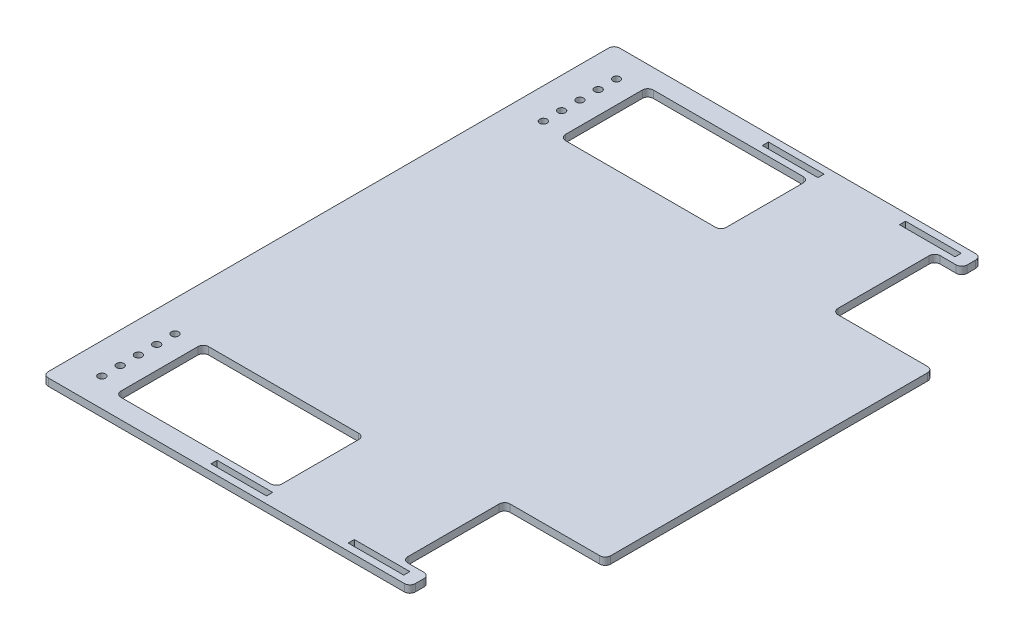
from build123d import *

# Parameters (mm, degrees)
SKETCH1_R           = 2
SKETCH1_W           = 30.4
SKETCH1_H           = 3.35
SKETCH1_W_2         = 88
SKETCH1_H_2         = 48
BOSS_EXTRUDE1_DEPTH = 4
FILLET1_R           = 3


with BuildPart() as part:
    # Sketch1 → Boss-Extrude1 (new body)
    with BuildSketch(Plane(origin=(0, 0, 0), x_dir=(1, 0, 0), z_dir=(0, 1, 0))):
        Polygon((-112.8, 156.215), (-112.8, -156.215), (87.95, -156.215), (87.95, -145.555), (73.17, -145.555), (73.17, -89.625), (128.17, -89.625), (128.17, 89.625), (73.17, 89.625), (73.17, 145.555), (87.95, 145.555), (87.95, 156.215), align=None)
        with Locations(Location((-96, 140.715, 0), (0, 0, 270))):
            Circle(SKETCH1_R, mode=Mode.SUBTRACT)
        with Locations(Location((-96, 130.715, 0), (0, 0, 270))):
            Circle(SKETCH1_R, mode=Mode.SUBTRACT)
        with Locations(Location((-96, 120.715, 0), (0, 0, 270))):
            Circle(SKETCH1_R, mode=Mode.SUBTRACT)
        with Locations(Location((-96, 110.715, 0), (0, 0, 270))):
            Circle(SKETCH1_R, mode=Mode.SUBTRACT)
        with Locations(Location((-96, 100.715, 0), (0, 0, 270))):
            Circle(SKETCH1_R, mode=Mode.SUBTRACT)
        with Locations(Location((-96, -100.715, 0), (0, 0, 90))):
            Circle(SKETCH1_R, mode=Mode.SUBTRACT)
        with Locations(Location((-96, -110.715, 0), (0, 0, 90))):
            Circle(SKETCH1_R, mode=Mode.SUBTRACT)
        with Locations(Location((-96, -120.715, 0), (0, 0, 90))):
            Circle(SKETCH1_R, mode=Mode.SUBTRACT)
        with Locations(Location((-96, -130.715, 0), (0, 0, 90))):
            Circle(SKETCH1_R, mode=Mode.SUBTRACT)
        with Locations(Location((-96, -140.715, 0), (0, 0, 90))):
            Circle(SKETCH1_R, mode=Mode.SUBTRACT)
        with Locations((65.59, 150.74)):
            Rectangle(SKETCH1_W, SKETCH1_H, mode=Mode.SUBTRACT)
        with Locations((-39.71, 121.555)):
            Rectangle(SKETCH1_W_2, SKETCH1_H_2, mode=Mode.SUBTRACT)
        with Locations((-9.41, 150.74)):
            Rectangle(SKETCH1_W, SKETCH1_H, mode=Mode.SUBTRACT)
        with Locations((65.59, -150.74)):
            Rectangle(SKETCH1_W, SKETCH1_H, mode=Mode.SUBTRACT)
        with Locations((-9.41, -150.74)):
            Rectangle(SKETCH1_W, SKETCH1_H, mode=Mode.SUBTRACT)
        with Locations((-39.71, -121.555)):
            Rectangle(SKETCH1_W_2, SKETCH1_H_2, mode=Mode.SUBTRACT)
    extrude(amount=BOSS_EXTRUDE1_DEPTH)

    # Fillet1
    fillet1_edges = [part.edges().sort_by_distance(p)[0] for p in [
        (-83.71, 2, 97.555),
        (-83.71, 2, 145.555),
        (4.29, 2, 145.555),
        (4.29, 2, 97.555),
        (87.95, 2, -156.215),
        (87.95, 2, -145.555),
        (73.17, 2, -145.555),
        (73.17, 2, -89.625),
        (128.17, 2, -89.625),
        (128.17, 2, 89.625),
        (73.17, 2, 89.625),
        (73.17, 2, 145.555),
        (87.95, 2, 145.555),
        (87.95, 2, 156.215),
        (-112.8, 2, 156.215),
        (-112.8, 2, -156.215),
        (-83.71, 2, -145.555),
        (-83.71, 2, -97.555),
        (4.29, 2, -97.555),
        (4.29, 2, -145.555),
    ]]
    fillet(fillet1_edges, radius=FILLET1_R)


solid = part.part
